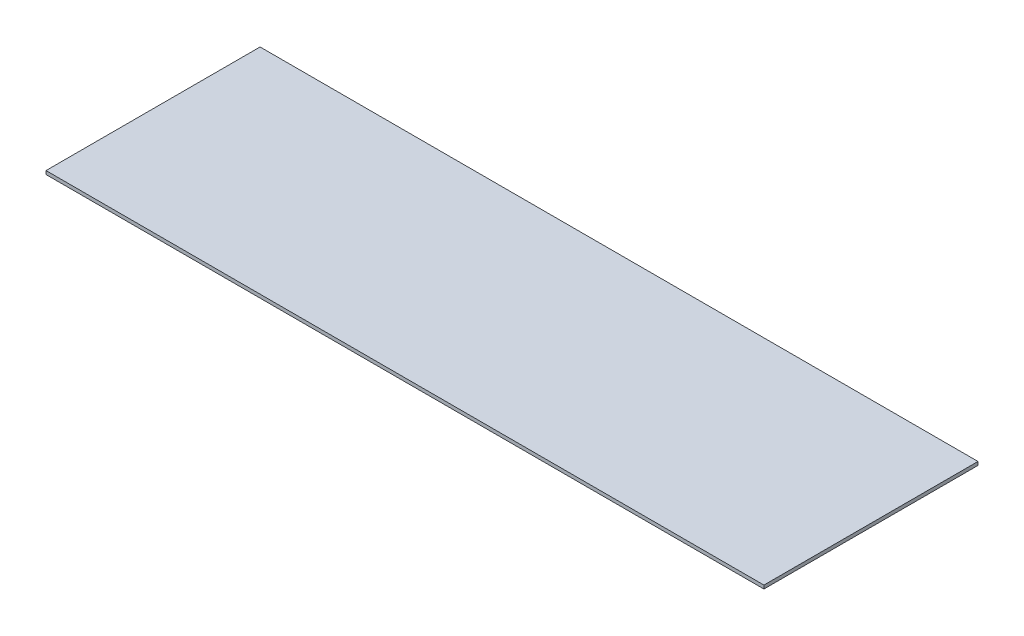
from build123d import *

# Parameters (mm, degrees)
BOSS_EXTRUDE4_DEPTH = 3.175


with BuildPart() as part:
    # Sketch1 → Boss-Extrude4 (new body)
    with BuildSketch(Plane(origin=(0, 0, 0), x_dir=(1, 0, 0), z_dir=(0, 1, 0))):
        Polygon((-657.606, 0), (0, 0), (0, 196.088), (-652.272, 196.088), (-657.606, 196.088), align=None)
    extrude(amount=BOSS_EXTRUDE4_DEPTH)


solid = part.part
